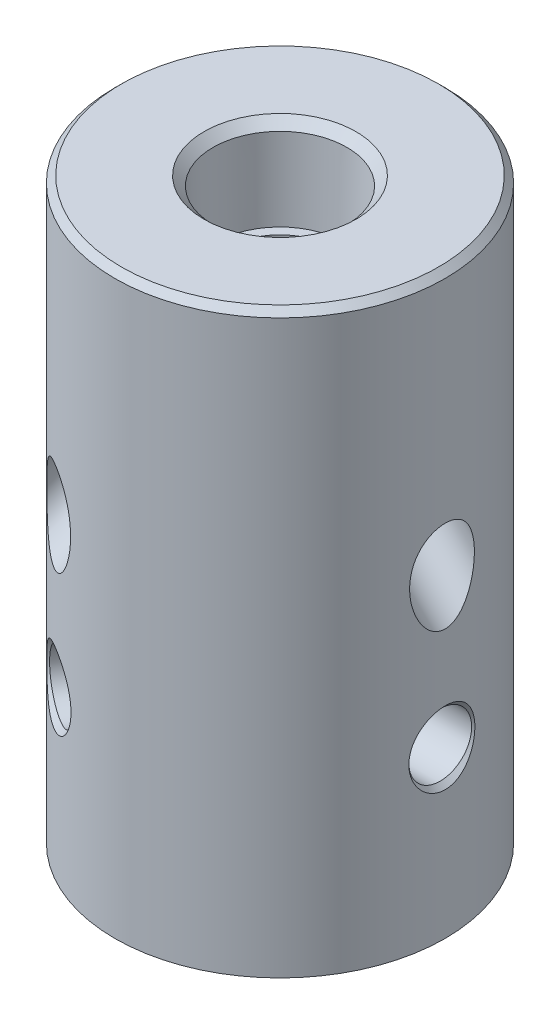
from build123d import *

# Parameters (mm, degrees)
CIRPATTERN1_COUNT = 3


with BuildPart() as part:
    # Sketch1 → Revolve1 (revolve)
    with BuildSketch(Plane.XY, mode=Mode.PRIVATE) as revolve1_sk:
        Polygon((0, 0), (2.54, 0), (12.7, 1.791482124), (12.7, 45.733482124), (12.192, 46.241482124), (0, 46.241482124), align=None)
    revolve(revolve1_sk.sketch.rotate(Axis((0, 46.241482124, 0), (0, -1, 0)), 90), axis=Axis((0, 46.241482124, 0), (0, -1, 0)))

    # Sketch4 → 1/8 NPT Tapped Hole1 (revolve, cut)
    with BuildSketch(Plane(origin=(0, 46.241482124, 0), x_dir=(0, 0, 1), z_dir=(1, 0, 0))):
        Polygon((0, 0), (0, 17.773468714), (4.2164, 15.24), (4.2164, 6.9342), (4.957090465, 6.9342), (5.1438048, 0.6981952), (5.842, 0), align=None)
    revolve(axis=Axis((0, 52.591482124, 0), (0, -1, 0)), mode=Mode.SUBTRACT)

    # Sketch2 → D (0.246) Diameter Hole1 (revolve, cut)
    with BuildSketch(Plane(origin=(6.35, 0.671805796, 0), x_dir=(0.9848077530122092, 0.17364817766692386, 0), z_dir=(0, 0, 1))):
        Polygon((0, 0), (0, 14.577208746), (3.1242, 12.7), (3.1242, 0.3048), (3.429, 0), align=None)
    d_0_246_diameter_hole1 = revolve(axis=Axis((7.452665928, -5.581723435, 0), (-0.17364817766692386, 0.9848077530122092, 0)), mode=Mode.SUBTRACT)

    # Sketch3 → #10-32 Tapped Hole1 (revolve, cut)
    with BuildSketch(Plane(origin=(12.7, 14.491482124, 0), x_dir=(0, 0, -1), z_dir=(0, 1, 0))):
        Polygon((0, 0), (0, 10.103317848), (2.0193, 8.89), (2.0193, 5.08), (2.413, 5.08), (2.413, 0.381), (2.794, 0), align=None)
    f_10_32_tapped_hole1 = revolve(axis=Axis((19.05, 14.491482124, 0), (-1, 0, 0)), mode=Mode.SUBTRACT)

    # Sketch7 → Cut-Revolve1 (revolve, cut)
    with BuildSketch(Plane.XY):
        Polygon((14.4601302, 24.161351924), (12.7, 22.401221725), (-0.702537278, 35.803759003), (0, 38.621482124), align=None)
    cut_revolve1 = revolve(axis=Axis((0, 38.621482124, 0), (0.7071067811865455, -0.7071067811865496, 0)), mode=Mode.SUBTRACT)

    # CirPattern1: D (0.246) Diameter Hole1, #10-32 Tapped Hole1, Cut-Revolve1 ×3 about axis
    cirpattern1_axis = Axis((0, 0, 0), (0, 1, 0))
    add([d_0_246_diameter_hole1.rotate(cirpattern1_axis, i * 360 / CIRPATTERN1_COUNT) for i in range(1, CIRPATTERN1_COUNT)], mode=Mode.SUBTRACT)
    add([f_10_32_tapped_hole1.rotate(cirpattern1_axis, i * 360 / CIRPATTERN1_COUNT) for i in range(1, CIRPATTERN1_COUNT)], mode=Mode.SUBTRACT)
    add([cut_revolve1.rotate(cirpattern1_axis, i * 360 / CIRPATTERN1_COUNT) for i in range(1, CIRPATTERN1_COUNT)], mode=Mode.SUBTRACT)


solid = part.part
